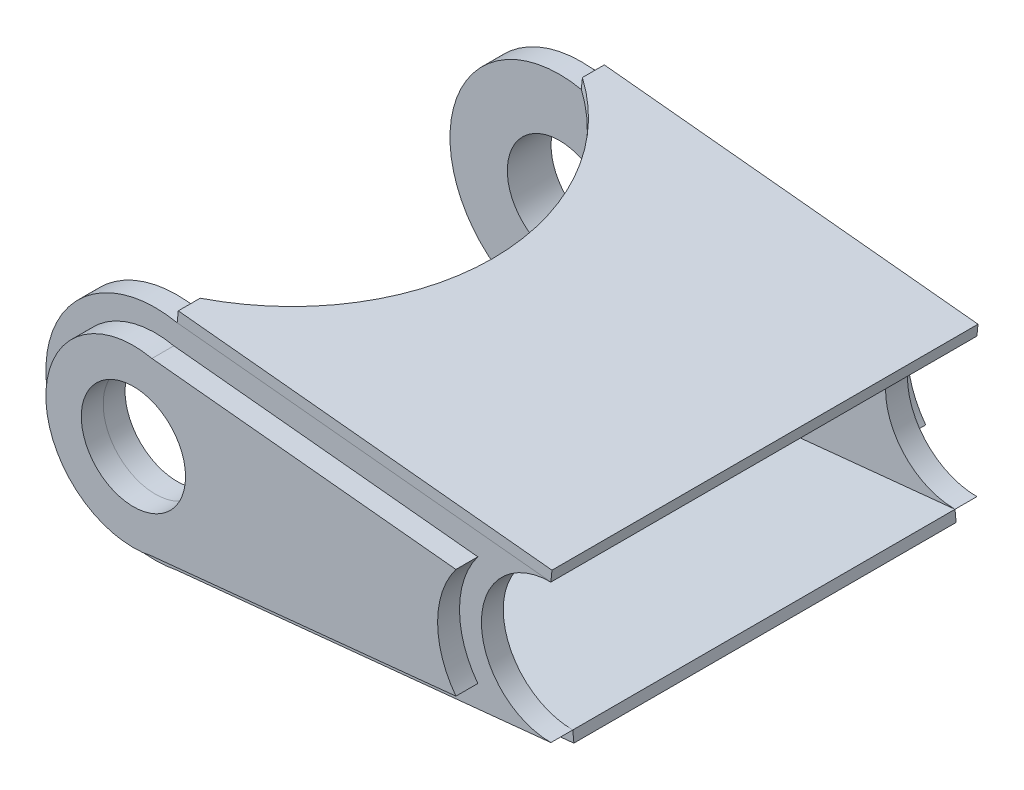
from build123d import *

# Parameters (mm, degrees)
BOSS_EXTRUDE1_DEPTH = 4
BOSS_EXTRUDE2_START = -4
BOSS_EXTRUDE2_DEPTH = 4
BOSS_EXTRUDE3_DEPTH = 4
CUT_EXTRUDE1_START  = -8
SKETCH6_R           = 9.525
CUT_EXTRUDE1_DEPTH  = 8
BOSS_EXTRUDE4_DEPTH = 2
BOSS_EXTRUDE5_DEPTH = 2


with BuildPart() as part:
    # Sketch1 → Boss-Extrude1 (new body)
    with BuildSketch(Plane.XY.offset(34.925)):
        with BuildLine():
            Line((0, 12.7), (-68.288930824, 19.596194833))
            ThreePointArc((-68.288930824, 19.596194833), (-92.287574102, 0), (-68.288930824, -19.596194833))
            Line((-68.288930824, -19.596194833), (0, -12.7))
            ThreePointArc((0, -12.7), (-12.7, 0), (0, 12.7))
        make_face()
    extrude(amount=BOSS_EXTRUDE1_DEPTH)


with BuildPart() as body_2:
    # Sketch2 → Boss-Extrude2 (new body)
    with BuildSketch(Plane.XY.offset(-34.925).offset(BOSS_EXTRUDE2_START)):
        with BuildLine():
            Line((-68.288930824, -19.596194833), (0, -12.7))
            ThreePointArc((0, -12.7), (-12.7, 0), (0, 12.7))
            Line((0, 12.7), (-68.288930824, 19.596194833))
            ThreePointArc((-68.288930824, 19.596194833), (-92.287574102, 0), (-68.288930824, -19.596194833))
        make_face()
    extrude(amount=BOSS_EXTRUDE2_DEPTH)


with BuildPart() as body_3:
    # Sketch5 → Boss-Extrude3 (new body)
    with BuildSketch(Plane.XY.offset(38.925)):
        with BuildLine():
            Line((-13.353845377, 10.028200918), (-68.902470005, 15.637808998))
            ThreePointArc((-68.902470005, 15.637808998), (-88.287574102, 0), (-68.902470005, -15.637808998))
            Line((-68.902470005, -15.637808998), (-13.353845377, -10.028200918))
            ThreePointArc((-13.353845377, -10.028200918), (-16.7, 0), (-13.353845377, 10.028200918))
        make_face()
    boss_extrude3 = extrude(amount=BOSS_EXTRUDE3_DEPTH)


with BuildPart() as cut_extrude1_tool:
    # Sketch6 → Cut-Extrude1 (new body)
    with BuildSketch(Plane.XY.offset(42.925).offset(CUT_EXTRUDE1_START)):
        with Locations((-72.287574102, 0)):
            Circle(SKETCH6_R)
    cut_extrude1 = extrude(amount=CUT_EXTRUDE1_DEPTH)


with BuildPart() as part_1:
    add(part.part)

    # Cut-Extrude1: cut by cut_extrude1_tool
    add(cut_extrude1_tool.part, mode=Mode.SUBTRACT)


with BuildPart() as body_3_1:
    add(body_3.part)

    # Cut-Extrude1: cut by cut_extrude1_tool
    add(cut_extrude1_tool.part, mode=Mode.SUBTRACT)


with BuildPart() as body_2_1:
    add(body_2.part)

    # Mirror1: Boss-Extrude3, Cut-Extrude1 across plane
    add(boss_extrude3.mirror(Plane.XY))
    add(cut_extrude1.mirror(Plane.XY), mode=Mode.SUBTRACT)


with BuildPart() as body_4:
    # Sketch7 → Boss-Extrude4 (new body)
    with BuildSketch(Plane(origin=(1.269569241, 12.571791859, 0), x_dir=(0.9949396317493256, -0.10047452002630568, 0), z_dir=(0.10047452002630568, 0.9949396317493256, 0))):
        with BuildLine():
            Line((-1.276026404, -38.925), (-1.276026404, 38.925))
            Line((-1.276026404, 38.925), (-69.912281957, 38.925))
            Line((-69.912281957, 38.925), (-69.912281957, 34.925))
            ThreePointArc((-69.912281957, 34.925), (-51.241327694, 0), (-69.912281957, -34.925))
            Line((-69.912281957, -34.925), (-69.912281957, -38.925))
            Line((-69.912281957, -38.925), (-1.276026404, -38.925))
        make_face()
    extrude(amount=BOSS_EXTRUDE4_DEPTH)


with BuildPart() as body_5:
    # Sketch8 → Boss-Extrude5 (new body)
    with BuildSketch(Plane(origin=(1.269569241, -12.571791859, 0), x_dir=(-0.9949396317493256, -0.10047452002630568, 0), z_dir=(0.10047452002630568, -0.9949396317493256, 0))):
        with BuildLine():
            Line((69.912281957, 34.925), (1.276026404, 34.925))
            Line((1.276026404, 34.925), (1.276026404, -34.925))
            Line((1.276026404, -34.925), (69.912281957, -34.925))
            ThreePointArc((69.912281957, -34.925), (51.241327694, 0), (69.912281957, 34.925))
        make_face()
    extrude(amount=BOSS_EXTRUDE5_DEPTH)


solid = Compound([part_1.part, body_3_1.part, body_2_1.part, body_4.part, body_5.part])
